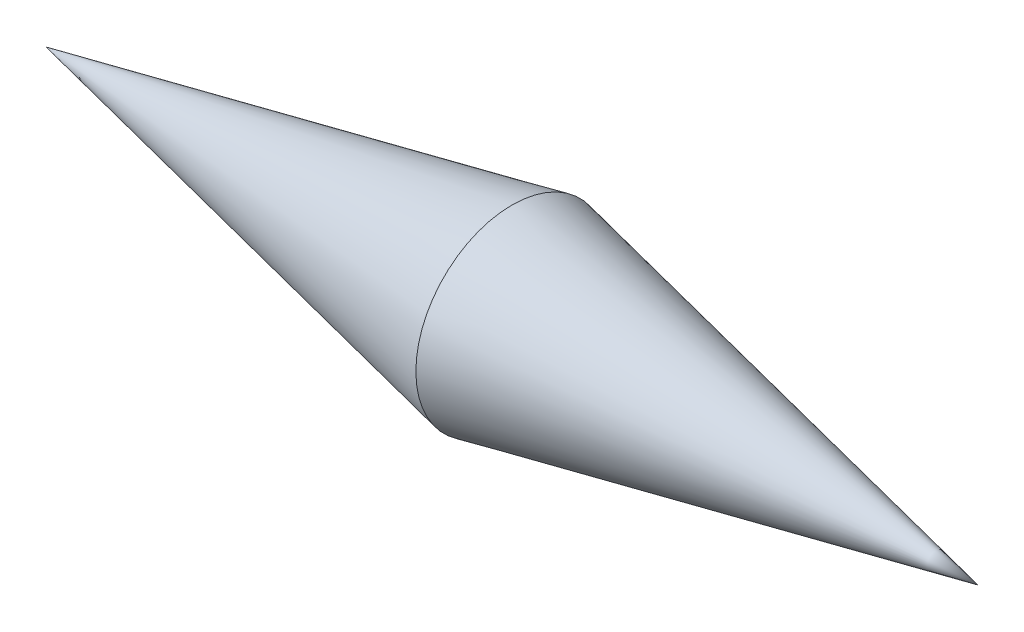
from build123d import *


with BuildPart() as part:
    # Sketch1 → Revolve1 (revolve)
    with BuildSketch(Plane.XY):
        Polygon((0, 0), (3.078034611, 0.635), (6.156069222, 0), align=None)
    revolve(axis=Axis((6.156069222, 0, 0), (-1, 0, 0)))


solid = part.part
